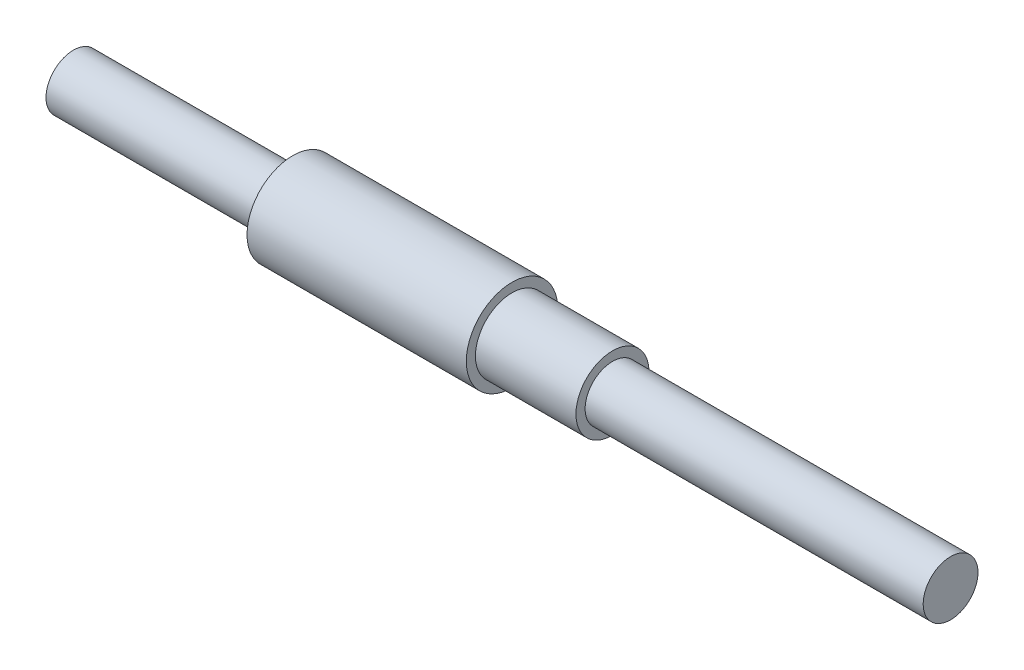
from build123d import *

# Parameters (mm, degrees)
SKETCH_1_R      = 1.5
EXTRUDE_1_DEPTH = 48
EXTRUDE_START   = -12
SKETCH_2_R      = 2.5
SKETCH_2_R_2    = 1.5
EXTRUDE_2_DEPTH = 12
EXTRUDE_START_2 = 24
SKETCH_3_R      = 2
SKETCH_3_R_2    = 1.5
EXTRUDE_3_DEPTH = 5.5


with BuildPart() as part:
    # 草图1 → 凸台-拉伸1 (new body)
    with BuildSketch(Plane(origin=(0, 0, 0), x_dir=(0, 0, -1), z_dir=(1, 0, 0))):
        Circle(SKETCH_1_R)
    extrude(amount=EXTRUDE_1_DEPTH)

    # 草图2 → 凸台-拉伸2 (add)
    with BuildSketch(Plane.ZY.offset(EXTRUDE_START)):
        Circle(SKETCH_2_R)
        Circle(SKETCH_2_R_2, mode=Mode.SUBTRACT)
    extrude(amount=-EXTRUDE_2_DEPTH)

    # 草图3 → 凸台-拉伸3 (add)
    with BuildSketch(Plane(origin=(0, 0, 0), x_dir=(0, 0, -1), z_dir=(1, 0, 0)).offset(EXTRUDE_START_2)):
        with Locations(Location((0, 0, 0), (0, 0, 180))):
            Circle(SKETCH_3_R)
        with Locations(Location((0, 0, 0), (0, 0, 180))):
            Circle(SKETCH_3_R_2, mode=Mode.SUBTRACT)
    extrude(amount=EXTRUDE_3_DEPTH)


solid = part.part
